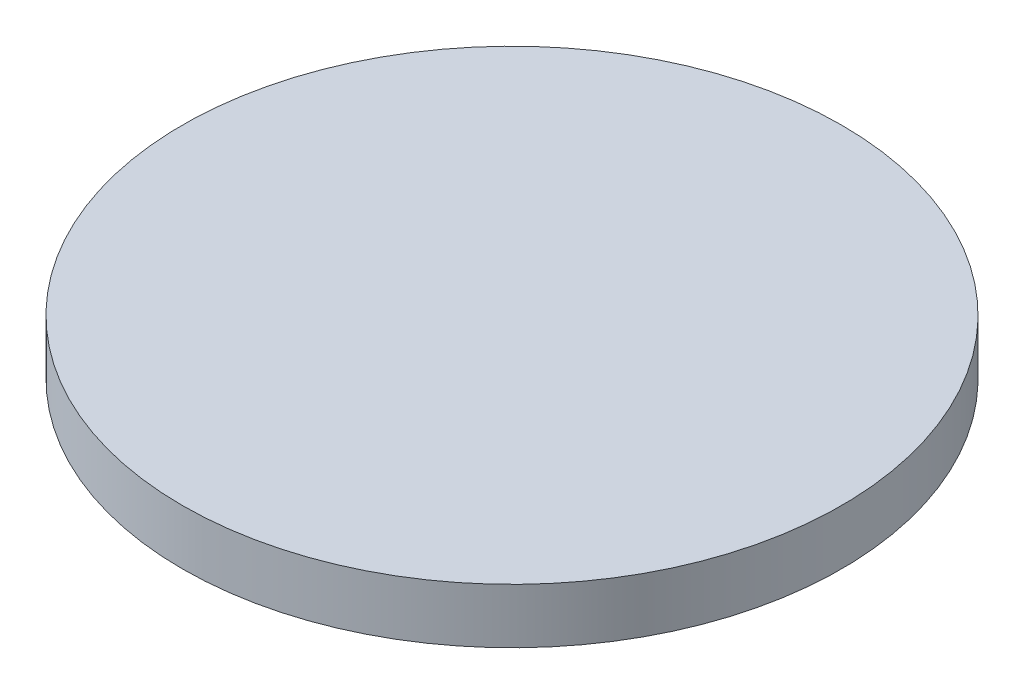
from build123d import *

# Parameters (mm, degrees)
SKETCH1_R           = 76.2
BOSS_EXTRUDE1_DEPTH = 12.7


with BuildPart() as part:
    # Sketch1 → Boss-Extrude1 (new body)
    with BuildSketch(Plane(origin=(0, 0, 0), x_dir=(1, 0, 0), z_dir=(0, 1, 0))):
        with Locations(Location((0, 0, 0), (0, 0, 270))):
            Circle(SKETCH1_R)
    extrude(amount=BOSS_EXTRUDE1_DEPTH)


solid = part.part
